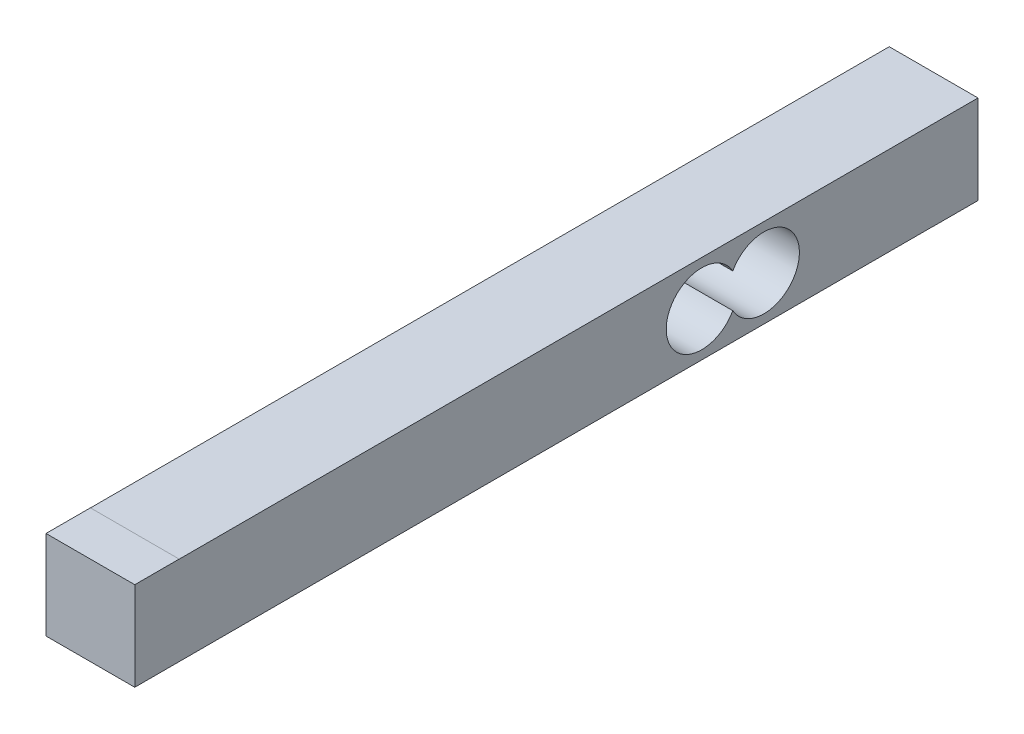
from build123d import *

# Parameters (mm, degrees)
ESQUISSE1_W             = 10
ESQUISSE1_H             = 10
BOSS_EXTRU_1_DEPTH      = 95
ESQUISSE2_W             = 10
ESQUISSE2_H             = 5
BOSS_EXTRU_2_DEPTH      = 0.01
ESQUISSE3_W             = 10
ESQUISSE3_H             = 5
BOSS_EXTRU_3_DEPTH      = 0.01
ENL_V_MAT_EXTRU_2_DEPTH = 96.656155578


with BuildPart() as part:
    # Esquisse1 → Boss.-Extru.1 (new body)
    with BuildSketch(Plane.XY):
        Rectangle(ESQUISSE1_W, ESQUISSE1_H)
    extrude(amount=BOSS_EXTRU_1_DEPTH)

    # Esquisse2 → Boss.-Extru.2 (add)
    with BuildSketch(Plane(origin=(0, 5, 0), x_dir=(1, 0, 0), z_dir=(0, 1, 0))):
        with Locations((0, -92.5)):
            Rectangle(ESQUISSE2_W, ESQUISSE2_H)
    extrude(amount=BOSS_EXTRU_2_DEPTH)

    # Esquisse3 → Boss.-Extru.3 (add)
    with BuildSketch(Plane.XZ.offset(5)):
        with Locations((0, 2.5)):
            Rectangle(ESQUISSE3_W, ESQUISSE3_H)
    extrude(amount=BOSS_EXTRU_3_DEPTH)

    # Esquisse6 → Enlèv. mat.-Extru.2 (cut, through all)
    with BuildSketch(Plane(origin=(5, 0, 0), x_dir=(0, 0, -1), z_dir=(1, 0, 0))):
        with BuildLine():
            ThreePointArc((-27.625, 1.931491673), (-35.125, -0.005), (-27.625, -1.941491673))
            ThreePointArc((-27.625, -1.941491673), (-20.125, -0.005), (-27.625, 1.931491673))
        make_face()
    extrude(amount=-ENL_V_MAT_EXTRU_2_DEPTH, mode=Mode.SUBTRACT)


solid = part.part
